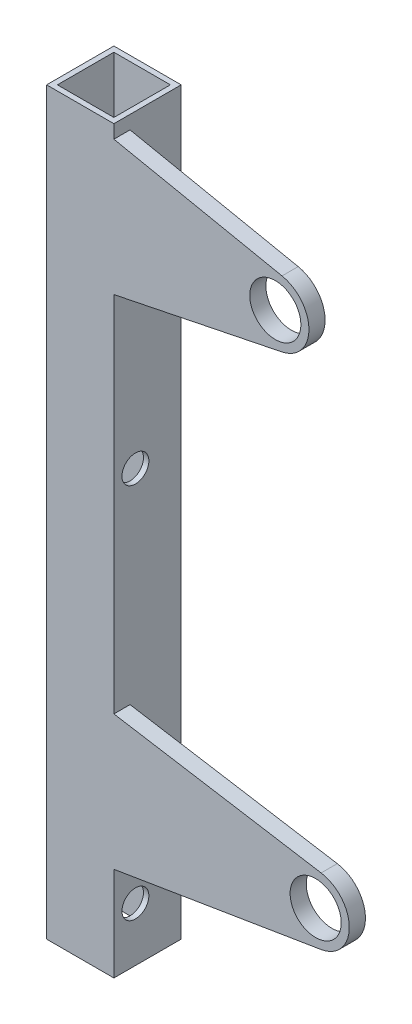
from build123d import *

# Parameters (mm, degrees)
SKETCH1_W           = 25
SKETCH1_H           = 25
SKETCH1_W_2         = 21
SKETCH1_H_2         = 21
BOSS_EXTRUDE1_DEPTH = 275
SKETCH2_R           = 9.5
BOSS_EXTRUDE2_DEPTH = 6
CUT_EXTRUDE1_REACH  = 290.856
SKETCH3_R           = 5


with BuildPart() as part:
    # Sketch1 → Boss-Extrude1 (new body)
    with BuildSketch(Plane(origin=(0, 0, 0), x_dir=(1, 0, 0), z_dir=(0, 1, 0))):
        Rectangle(SKETCH1_W, SKETCH1_H)
        Rectangle(SKETCH1_W_2, SKETCH1_H_2, mode=Mode.SUBTRACT)
    extrude(amount=-BOSS_EXTRUDE1_DEPTH)

    # Sketch2 → Boss-Extrude2 (add)
    # profile 1 of 2: a face of its own
    with BuildSketch(Plane.XY.offset(12.5)):
        with BuildLine():
            Line((74.999020274, -17.752351341), (12.5, -5))
            Line((12.5, -5), (12.5, -55))
            Line((12.5, -55), (74.999020274, -42.247648659))
            ThreePointArc((74.999020274, -42.247648659), (85, -30), (74.999020274, -17.752351341))
        make_face()
        with Locations((72.5, -30)):
            Circle(SKETCH2_R, mode=Mode.SUBTRACT)
    # profile 2 of 2: a face of its own
    with BuildSketch(Plane.XY.offset(12.5)):
        with BuildLine():
            Line((89.528123749, -202.665628753), (12.5, -190))
            Line((12.5, -190), (12.5, -240))
            Line((12.5, -240), (89.528123749, -227.334371247))
            ThreePointArc((89.528123749, -227.334371247), (100, -215), (89.528123749, -202.665628753))
        make_face()
        with Locations((87.5, -215)):
            Circle(SKETCH2_R, mode=Mode.SUBTRACT)
    extrude(amount=-BOSS_EXTRUDE2_DEPTH)

    # Cut-Extrude1: up to this face of the body (flat: up to its plane)
    cut_extrude1_end = Plane(part.part.faces().sort_by_distance((-12.5, -137.5, 0))[0])
    # Sketch3 → Cut-Extrude1 (cut, up to the picked face)
    with BuildSketch(Plane(origin=(12.5, 0, 0), x_dir=(0, 0, -1), z_dir=(1, 0, 0)), mode=Mode.PRIVATE) as cut_extrude1_sk1:
        with Locations((-4.5, -115)):
            Circle(SKETCH3_R)
    cut_extrude1_tool1 = split(extrude(cut_extrude1_sk1.sketch, amount=-CUT_EXTRUDE1_REACH, mode=Mode.PRIVATE), bisect_by=cut_extrude1_end, keep=Keep.BOTH, mode=Mode.PRIVATE)
    # Sketch3 → Cut-Extrude1 (cut, up to the picked face)
    with BuildSketch(Plane(origin=(12.5, 0, 0), x_dir=(0, 0, -1), z_dir=(1, 0, 0)), mode=Mode.PRIVATE) as cut_extrude1_sk2:
        with Locations((-4.5, -255)):
            Circle(SKETCH3_R)
    cut_extrude1_tool2 = split(extrude(cut_extrude1_sk2.sketch, amount=-CUT_EXTRUDE1_REACH, mode=Mode.PRIVATE), bisect_by=cut_extrude1_end, keep=Keep.BOTH, mode=Mode.PRIVATE)
    add(cut_extrude1_tool1.solids().sort_by(Axis((12.5, -115, 4.5), (-1, 0, 0)))[0], mode=Mode.SUBTRACT)
    add(cut_extrude1_tool2.solids().sort_by(Axis((12.5, -255, 4.5), (-1, 0, 0)))[0], mode=Mode.SUBTRACT)


solid = part.part
